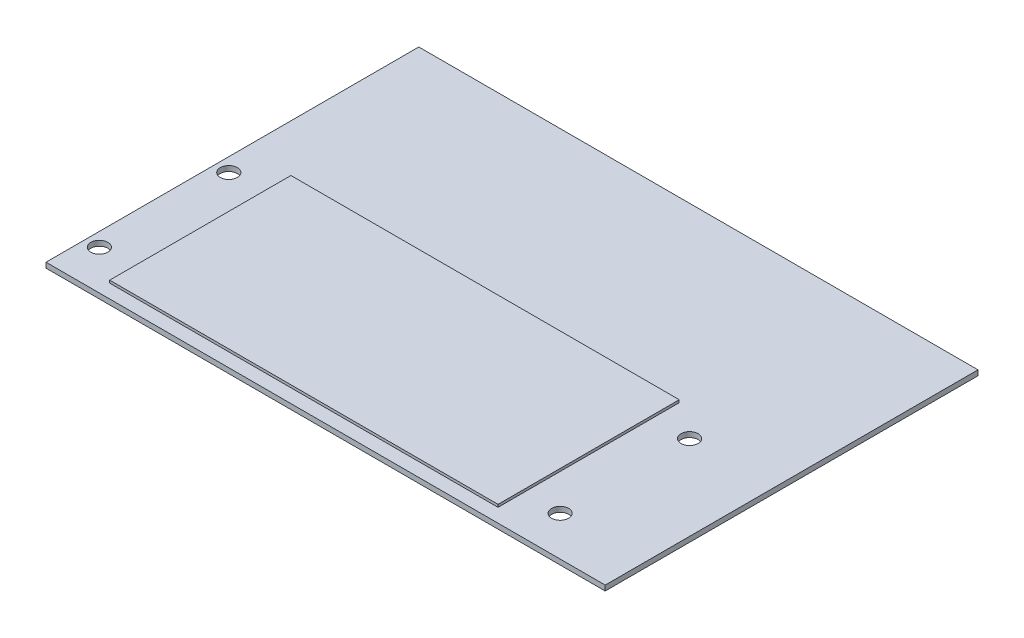
from build123d import *

# Parameters (mm, degrees)
SKETCH1_W           = 108
SKETCH1_H           = 72
SKETCH1_R           = 1.65
BOSS_EXTRUDE1_DEPTH = 1
SKETCH2_W           = 75
SKETCH2_H           = 35
BOSS_EXTRUDE2_DEPTH = 0.5


with BuildPart() as part:
    # Sketch1 → Boss-Extrude1 (new body)
    with BuildSketch(Plane(origin=(0, 0, 0), x_dir=(1, 0, 0), z_dir=(0, 1, 0))):
        with Locations((6.85, 15.85)):
            Rectangle(SKETCH1_W, SKETCH1_H)
        with Locations(Location((-44.5, 12.5, 0), (0, 0, 270))):
            Circle(SKETCH1_R, mode=Mode.SUBTRACT)
        with Locations(Location((-44.5, -12.5, 0), (0, 0, 270))):
            Circle(SKETCH1_R, mode=Mode.SUBTRACT)
        with Locations(Location((44.5, 12.5, 0), (0, 0, 270))):
            Circle(SKETCH1_R, mode=Mode.SUBTRACT)
        with Locations(Location((44.5, -12.5, 0), (0, 0, 270))):
            Circle(SKETCH1_R, mode=Mode.SUBTRACT)
    extrude(amount=BOSS_EXTRUDE1_DEPTH)

    # Sketch2 → Boss-Extrude2 (add)
    with BuildSketch(Plane(origin=(0, 1, 0), x_dir=(1, 0, 0), z_dir=(0, 1, 0))):
        Rectangle(SKETCH2_W, SKETCH2_H)
    extrude(amount=BOSS_EXTRUDE2_DEPTH)


solid = part.part
